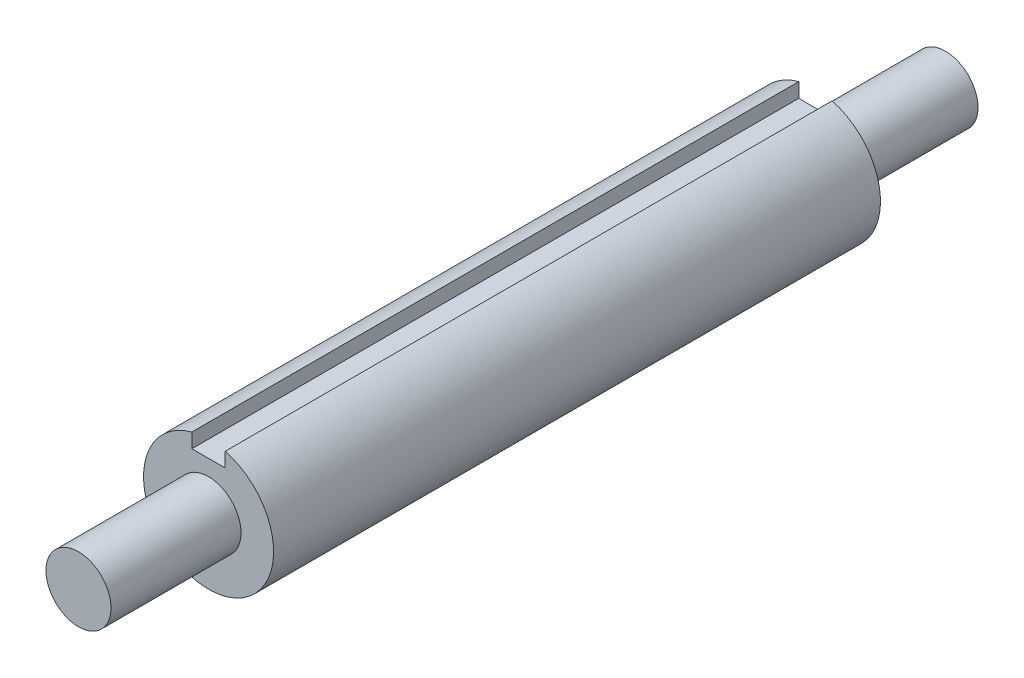
from build123d import *

# Parameters (mm, degrees)
SKETCH1_R                      = 3.75
BOSS_EXTRUDE1_DEPTH            = 100
BOSS_EXTRUDE2_DEPTH            = 35
BOSS_EXTRUDE2_DEPTH_BACK       = 35
SKETCH2_R                      = 7.5
CUT_EXTRUDE1_REACH             = 53.113
SKETCH3_W                      = 3.85
SKETCH3_H                      = 3.85
CUT_EXTRUDE1_DIRECTION_2_REACH = 53.113


with BuildPart() as part:
    # Sketch1 → Boss-Extrude1 (new body)
    with BuildSketch(Plane.XY):
        Circle(SKETCH1_R)
    extrude(amount=BOSS_EXTRUDE1_DEPTH)

    # Sketch2 → Boss-Extrude2 (add, two sides: drawn at the far end of the back side and taken through both)
    with BuildSketch(Plane(origin=(0, 0, 50), x_dir=(-1, 0, 0), z_dir=(0, 0, -1)).offset(-BOSS_EXTRUDE2_DEPTH_BACK)):
        Circle(SKETCH2_R)
    extrude(amount=BOSS_EXTRUDE2_DEPTH + BOSS_EXTRUDE2_DEPTH_BACK)

    # Cut-Extrude1: up to this face of the body (flat: up to its plane)
    cut_extrude1_end = Plane(part.part.faces().sort_by_distance((7.287867966, 0, 85))[0])
    # Sketch3 → Cut-Extrude1 (cut, up to the picked face)
    with BuildSketch(Plane(origin=(0, 0, 50), x_dir=(-1, 0, 0), z_dir=(0, 0, -1)), mode=Mode.PRIVATE) as cut_extrude1_sk1:
        with Locations((0, 7.5)):
            Rectangle(SKETCH3_W, SKETCH3_H)
    cut_extrude1_tool1 = split(extrude(cut_extrude1_sk1.sketch, amount=-CUT_EXTRUDE1_REACH, mode=Mode.PRIVATE), bisect_by=cut_extrude1_end, keep=Keep.BOTH, mode=Mode.PRIVATE)
    add(cut_extrude1_tool1.solids().sort_by(Axis((0, 7.5, 50), (0, 0, 1)))[0], mode=Mode.SUBTRACT)

    # Cut-Extrude1 direction 2: up to this face of the body (flat: up to its plane)
    cut_extrude1_direction_2_end = Plane(part.part.faces().sort_by_distance((7.287867966, 0, 15))[0])
    # Sketch3 → Cut-Extrude1 direction 2 (cut, up to the picked face)
    with BuildSketch(Plane(origin=(0, 0, 50), x_dir=(-1, 0, 0), z_dir=(0, 0, -1)), mode=Mode.PRIVATE) as cut_extrude1_direction_2_sk1:
        with Locations((0, 7.5)):
            Rectangle(SKETCH3_W, SKETCH3_H)
    cut_extrude1_direction_2_tool1 = split(extrude(cut_extrude1_direction_2_sk1.sketch, amount=CUT_EXTRUDE1_DIRECTION_2_REACH, mode=Mode.PRIVATE), bisect_by=cut_extrude1_direction_2_end, keep=Keep.BOTH, mode=Mode.PRIVATE)
    add(cut_extrude1_direction_2_tool1.solids().sort_by(Axis((0, 7.5, 50), (0, 0, -1)))[0], mode=Mode.SUBTRACT)


solid = part.part
